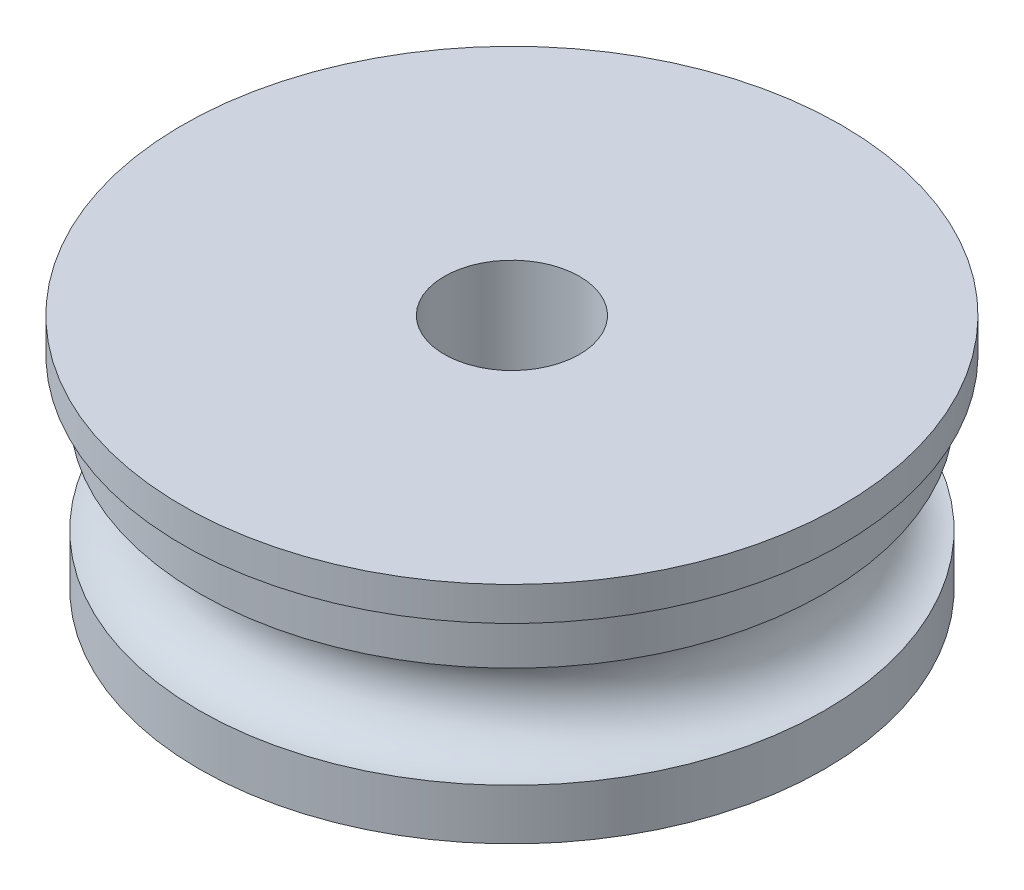
from build123d import *


with BuildPart() as part:
    # Sketch3 → Revolve2 (revolve)
    with BuildSketch(Plane.XY, mode=Mode.PRIVATE) as revolve2_sk:
        with BuildLine():
            Line((2, 0), (2, 4))
            Line((2, 4), (9.75, 4))
            Line((9.75, 4), (9.75, 3))
            Line((9.75, 3), (9.25, 3))
            Line((9.25, 3), (9.25, 1.5))
            ThreePointArc((9.25, 1.5), (7.75, 0), (9.25, -1.5))
            Line((9.25, -1.5), (9.25, -3))
            Line((9.25, -3), (6, -3))
            Line((6, -3), (6, 0))
            Line((6, 0), (2, 0))
        make_face()
    revolve(revolve2_sk.sketch.rotate(Axis((0, 0, 0), (0, 1, 0)), 90), axis=Axis((0, 0, 0), (0, 1, 0)))


solid = part.part
